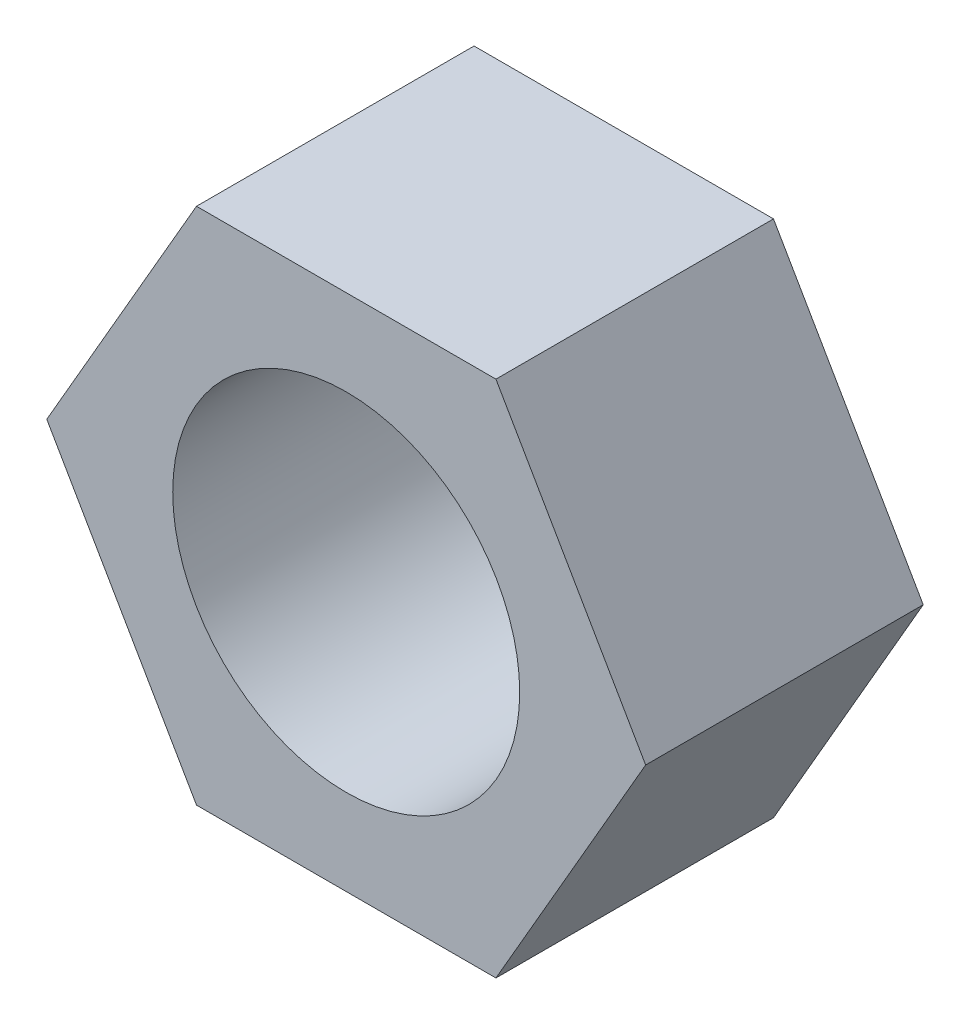
from build123d import *

# Parameters (mm, degrees)
SKETCH_1_R      = 1.5
EXTRUDE_1_DEPTH = 2.4


with BuildPart() as part:
    # 草图1 → 凸台-拉伸1 (new body)
    with BuildSketch(Plane.XY):
        Polygon((2.589097642, 0), (1.294548821, 2.242224331), (-1.294548821, 2.242224331), (-2.589097642, 0), (-1.294548821, -2.242224331), (1.294548821, -2.242224331), align=None)
        Circle(SKETCH_1_R, mode=Mode.SUBTRACT)
    extrude(amount=EXTRUDE_1_DEPTH)


solid = part.part
